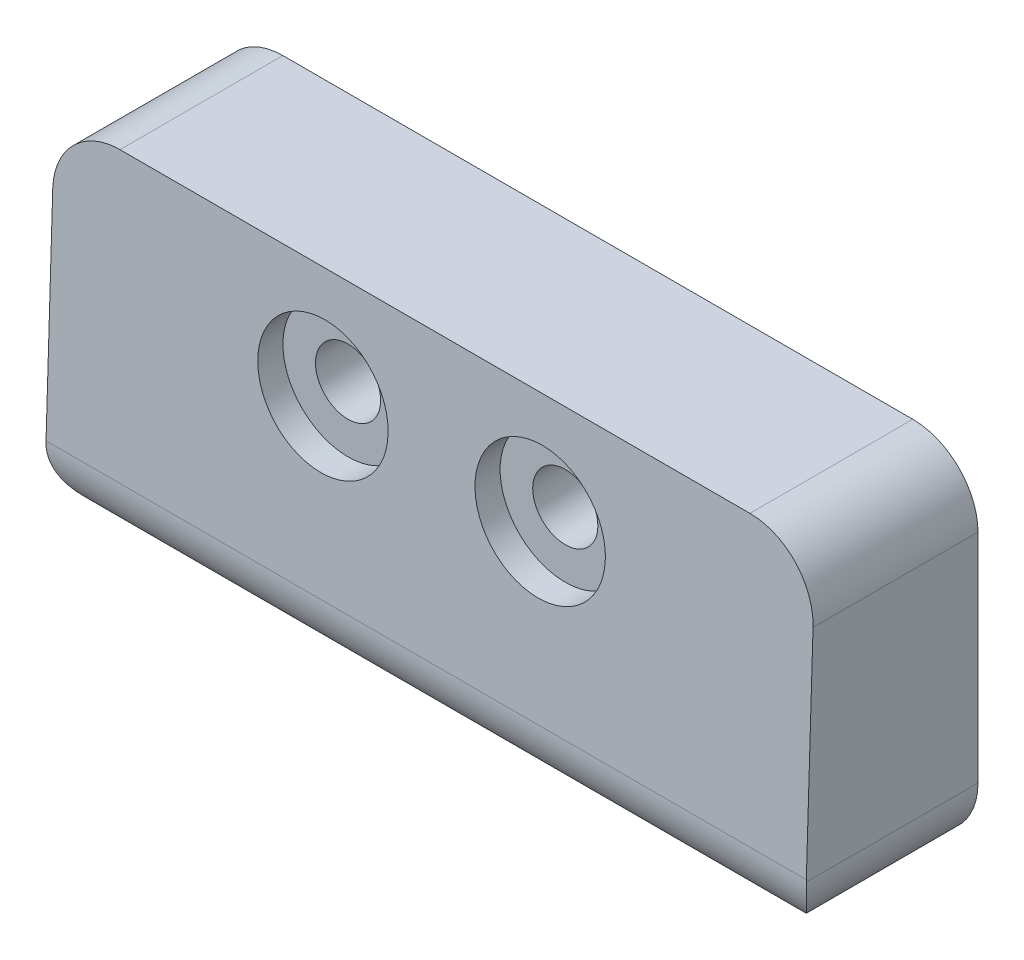
from build123d import *

# Parameters (mm, degrees)
SKETCH_1_W          = 35
SKETCH_1_H          = 10
SKETCH_1_R          = 1.5
EXTRUDE_1_DEPTH     = 8
CUT_EXTRUDE_START   = -1.5
SKETCH_2_R          = 3
SKETCH_2_R_2        = 1.5
CUT_EXTRUDE_1_DEPTH = 1.5
SKETCH_3_W          = 35
SKETCH_3_H          = 6
EXTRUDE_2_DEPTH     = 8
CUT_EXTRUDE_2_DEPTH = 38.549966711
FILLET_2_R          = 3


with BuildPart() as part:
    # 草图1 → 凸台-拉伸1 (new body)
    with BuildSketch(Plane.XY):
        Rectangle(SKETCH_1_W, SKETCH_1_H)
        with Locations((-5, 0)):
            Circle(SKETCH_1_R, mode=Mode.SUBTRACT)
        with Locations(Location((5, 0, 0), (0, 0, 180))):
            Circle(SKETCH_1_R, mode=Mode.SUBTRACT)
    extrude(amount=EXTRUDE_1_DEPTH)

    # 草图2 → 切除-拉伸1 (cut)
    # profile 1 of 2: a face of its own
    with BuildSketch(Plane.XY.offset(8).offset(CUT_EXTRUDE_START)):
        with Locations((-5, 0)):
            Circle(SKETCH_2_R)
        with Locations((-5, 0)):
            Circle(SKETCH_2_R_2, mode=Mode.SUBTRACT)
    # profile 2 of 2: a face of its own
    with BuildSketch(Plane.XY.offset(8).offset(CUT_EXTRUDE_START)):
        with Locations((5, 0)):
            Circle(SKETCH_2_R)
        with Locations(Location((5, 0, 0), (0, 0, 180))):
            Circle(SKETCH_2_R_2, mode=Mode.SUBTRACT)
    extrude(amount=CUT_EXTRUDE_1_DEPTH, mode=Mode.SUBTRACT)

    # 草图3 → 凸台-拉伸2 (add)
    with BuildSketch(Plane.XY.offset(8)):
        with Locations((0, -8)):
            Rectangle(SKETCH_3_W, SKETCH_3_H)
    extrude(amount=-EXTRUDE_2_DEPTH)

    # 草图4 → 切除-拉伸2 (cut, through all)
    with BuildSketch(Plane.ZY.offset(17.5)):
        Polygon((8, 5), (7.5, 5), (8, -11), align=None)
    extrude(amount=-CUT_EXTRUDE_2_DEPTH, mode=Mode.SUBTRACT)

    # 圆角2
    fillet_2_edges = [part.edges().sort_by_distance(p)[0] for p in [
        (0, -11, 8),
        (-17.5, -11, 4),
        (17.5, -11, 4),
        (-17.5, 5, 3.75),
        (17.5, 5, 3.75),
    ]]
    fillet(fillet_2_edges, radius=FILLET_2_R)


solid = part.part
